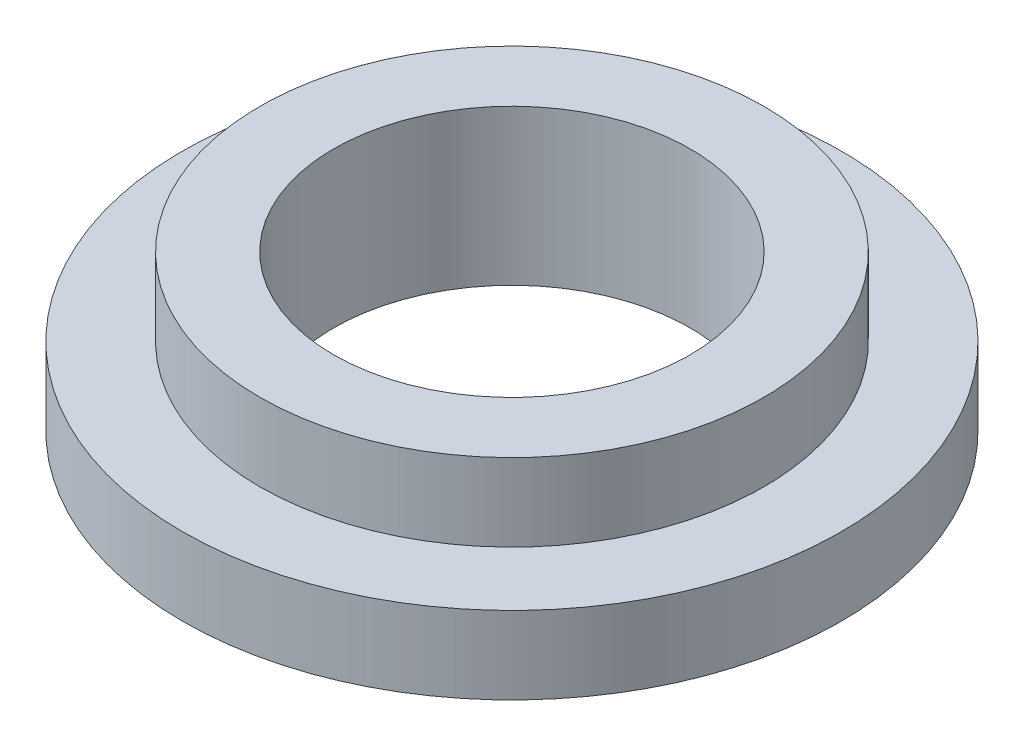
from build123d import *

# Parameters (mm, degrees)
SKETCH1_R           = 42.5
BOSS_EXTRUDE1_DEPTH = 10
SKETCH2_R           = 32.5
BOSS_EXTRUDE2_DEPTH = 10
SKETCH3_R           = 23
CUT_EXTRUDE1_DEPTH  = 64.344297297


with BuildPart() as part:
    # Sketch1 → Boss-Extrude1 (new body)
    with BuildSketch(Plane(origin=(0, 0, 0), x_dir=(1, 0, 0), z_dir=(0, 1, 0))):
        with Locations(Location((0, 0, 0), (0, 0, 270))):
            Circle(SKETCH1_R)
    extrude(amount=BOSS_EXTRUDE1_DEPTH)

    # Sketch2 → Boss-Extrude2 (add)
    with BuildSketch(Plane(origin=(0, 10, 0), x_dir=(1, 0, 0), z_dir=(0, 1, 0))):
        with Locations(Location((0, 0, 0), (0, 0, 270))):
            Circle(SKETCH2_R)
    extrude(amount=BOSS_EXTRUDE2_DEPTH)

    # Sketch3 → Cut-Extrude1 (cut, through all)
    with BuildSketch(Plane(origin=(0, 20, 0), x_dir=(1, 0, 0), z_dir=(0, 1, 0))):
        with Locations(Location((0, 0, 0), (0, 0, 270))):
            Circle(SKETCH3_R)
    extrude(amount=-CUT_EXTRUDE1_DEPTH, mode=Mode.SUBTRACT)


solid = part.part
